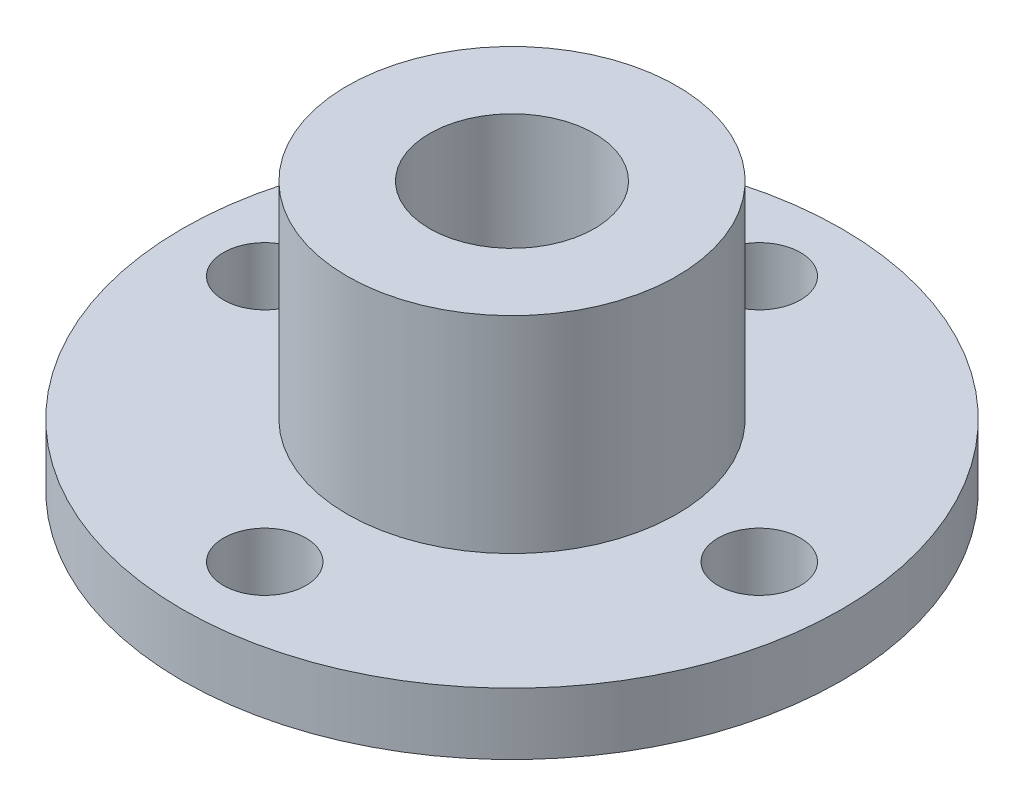
from build123d import *

# Parameters (mm, degrees)
SKETCH_1_R          = 16
SKETCH_1_R_2        = 2
EXTRUDE_1_DEPTH     = 3
SKETCH_2_R          = 8
EXTRUDE_2_DEPTH     = 10
SKETCH_3_R          = 4
CUT_EXTRUDE_1_DEPTH = 27.095976701


with BuildPart() as part:
    # 草图1 → 凸台-拉伸1 (new body)
    with BuildSketch(Plane(origin=(0, 0, 0), x_dir=(1, 0, 0), z_dir=(0, 1, 0))):
        with Locations(Location((0, 0, 0), (0, 0, 270))):
            Circle(SKETCH_1_R)
        with Locations(Location((-12, 0, 0), (0, 0, 270))):
            Circle(SKETCH_1_R_2, mode=Mode.SUBTRACT)
        with Locations(Location((12, 0, 0), (0, 0, 90))):
            Circle(SKETCH_1_R_2, mode=Mode.SUBTRACT)
        with Locations(Location((0, -12, 0), (0, 0, 90))):
            Circle(SKETCH_1_R_2, mode=Mode.SUBTRACT)
        with Locations(Location((0, 12, 0), (0, 0, 270))):
            Circle(SKETCH_1_R_2, mode=Mode.SUBTRACT)
    extrude(amount=EXTRUDE_1_DEPTH)

    # 草图2 → 凸台-拉伸2 (add)
    with BuildSketch(Plane(origin=(0, 3, 0), x_dir=(1, 0, 0), z_dir=(0, 1, 0))):
        with Locations(Location((0, 0, 0), (0, 0, 270))):
            Circle(SKETCH_2_R)
    extrude(amount=EXTRUDE_2_DEPTH)

    # 草图3 → 切除-拉伸1 (cut, through all)
    with BuildSketch(Plane(origin=(0, 13, 0), x_dir=(1, 0, 0), z_dir=(0, 1, 0))):
        with Locations(Location((0, 0, 0), (0, 0, 270))):
            Circle(SKETCH_3_R)
    extrude(amount=-CUT_EXTRUDE_1_DEPTH, mode=Mode.SUBTRACT)


solid = part.part
